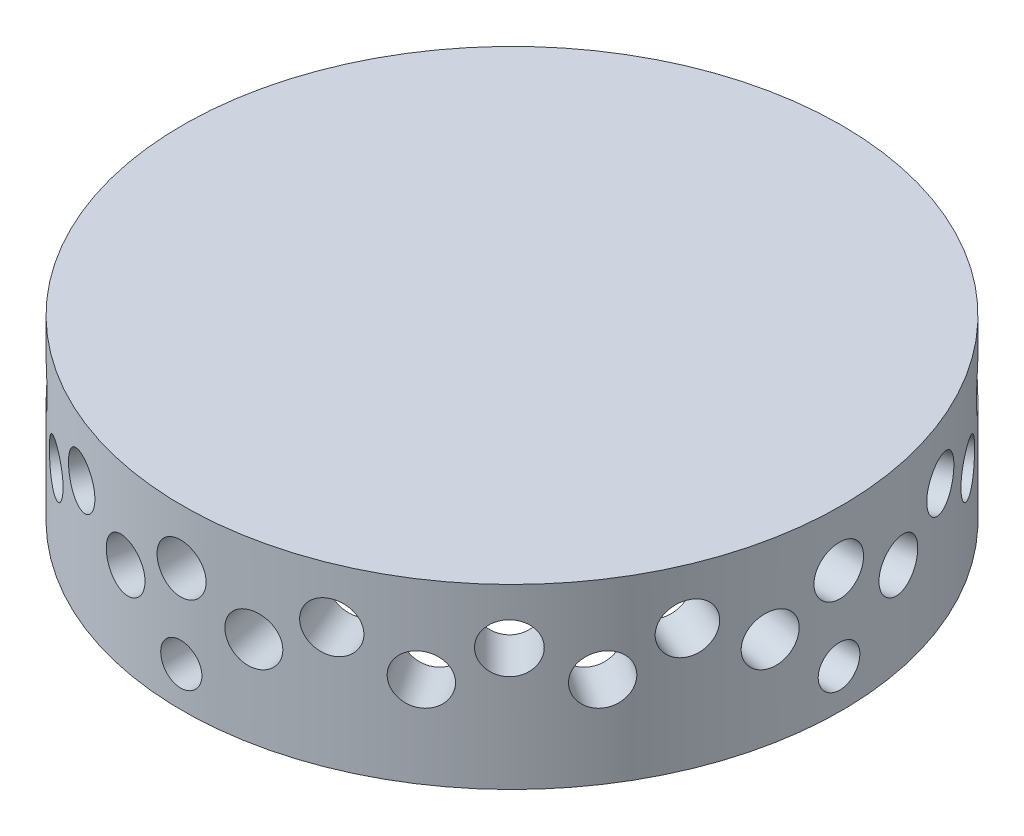
from build123d import *

# Parameters (mm, degrees)
WYTNIJ_WYCI_GNI_CIE2_REACH      = 201.702
WYTNIJ_WYCI_GNI_CIE2_END_RADIUS = 70.5
SZKIC2_R                        = 6.25
SZKIC4_R                        = 5.25
WYTNIJ_WYCI_GNI_CIE4_DEPTH      = 30
SZYK_KO_OWY2_COUNT              = 4
WYTNIJ_WYCI_GNI_CIE5_REACH      = 207.75
WYTNIJ_WYCI_GNI_CIE5_END_RADIUS = 70.5
SZKIC8_R                        = 6.25
SZYK_KO_OWY3_COUNT              = 16
SZYK_KO_OWY4_COUNT              = 16


with BuildPart() as part:
    # Szkic1 → Obrót1 (revolve)
    with BuildSketch(Plane.XY, mode=Mode.PRIVATE) as obr_t1_sk:
        Polygon((0, 70.848451872), (-83.5, 70.848451872), (-83.5, 40.848451872), (-83.5, 25.848451872), (-70.5, 25.848451872), (-70.5, 65.848451872), (0, 65.848451872), align=None)
    revolve(obr_t1_sk.sketch.rotate(Axis((0, -200.62943078, 0), (0, 1, 0)), 270), axis=Axis((0, -200.62943078, 0), (0, 1, 0)))

    # Wytnij-wyciągnięcie2: up to this cylinder (the profile starts outside it)
    wytnij_wyci_gni_cie2_end = Plane(origin=(0, 56.848452, 0), z_dir=(0, -1, 0)) * Cylinder(WYTNIJ_WYCI_GNI_CIE2_END_RADIUS, 545.404, mode=Mode.PRIVATE)
    # Szkic2 → Wytnij-wyciągnięcie2 (cut, up to the surface)
    with BuildSketch(Plane(origin=(83.5, 0, 0), x_dir=(0, 0, -1), z_dir=(1, 0, 0)), mode=Mode.PRIVATE) as wytnij_wyci_gni_cie2_sk1:
        with Locations((-0.467069002, 56.848451872)):
            Circle(SZKIC2_R)
    wytnij_wyci_gni_cie2_tool1 = extrude(wytnij_wyci_gni_cie2_sk1.sketch, amount=-WYTNIJ_WYCI_GNI_CIE2_REACH, mode=Mode.PRIVATE) - wytnij_wyci_gni_cie2_end
    wytnij_wyci_gni_cie2 = wytnij_wyci_gni_cie2_tool1.solids().sort_by_distance((83.5, 56.848452, 0.467069))[0]
    add(wytnij_wyci_gni_cie2, mode=Mode.SUBTRACT)

    # Szkic4 → Wytnij-wyciągnięcie4 (cut)
    with BuildSketch(Plane(origin=(83.5, 0, 0), x_dir=(0, 0, -1), z_dir=(1, 0, 0))):
        with Locations((-0.467069002, 35.848451872)):
            Circle(SZKIC4_R)
    wytnij_wyci_gni_cie4 = extrude(amount=-WYTNIJ_WYCI_GNI_CIE4_DEPTH, mode=Mode.SUBTRACT)

    # Szyk kołowy2: Wytnij-wyciągnięcie4 ×4 about axis
    szyk_ko_owy2_axis = Axis((0, 0, 0), (0, -1, 0))
    for i in range(1, SZYK_KO_OWY2_COUNT):
        add(wytnij_wyci_gni_cie4.rotate(szyk_ko_owy2_axis, i * 360 / SZYK_KO_OWY2_COUNT), mode=Mode.SUBTRACT)

    # Wytnij-wyciągnięcie5: up to this cylinder (the profile starts outside it)
    wytnij_wyci_gni_cie5_end = Plane(origin=(0, 48.848452, 0), z_dir=(0, -1, 0)) * Cylinder(WYTNIJ_WYCI_GNI_CIE5_END_RADIUS, 557.5, mode=Mode.PRIVATE)
    # Szkic8 → Wytnij-wyciągnięcie5 (cut, up to the surface)
    with BuildSketch(Plane(origin=(81.895570914, 0, 16.290041888), x_dir=(0, -1, 0), z_dir=(0.9807852804032304, 0, 0.19509032201612872)), mode=Mode.PRIVATE) as wytnij_wyci_gni_cie5_sk1:
        with Locations(Location((-48.848451872, 0, 0), (0, 0, 90))):
            Circle(SZKIC8_R)
    wytnij_wyci_gni_cie5_tool1 = extrude(wytnij_wyci_gni_cie5_sk1.sketch, amount=-WYTNIJ_WYCI_GNI_CIE5_REACH, mode=Mode.PRIVATE) - wytnij_wyci_gni_cie5_end
    wytnij_wyci_gni_cie5 = wytnij_wyci_gni_cie5_tool1.solids().sort_by_distance((81.895571, 48.848452, 16.290042))[0]
    add(wytnij_wyci_gni_cie5, mode=Mode.SUBTRACT)

    # Szyk kołowy3: Wytnij-wyciągnięcie2 ×16 about axis
    szyk_ko_owy3_axis = Axis((0, 0, 0), (0, -1, 0))
    for i in range(1, SZYK_KO_OWY3_COUNT):
        add(wytnij_wyci_gni_cie2.rotate(szyk_ko_owy3_axis, i * 360 / SZYK_KO_OWY3_COUNT), mode=Mode.SUBTRACT)

    # Szyk kołowy4: Wytnij-wyciągnięcie5 ×16 about axis
    szyk_ko_owy4_axis = Axis((0, 0, 0), (0, -1, 0))
    for i in range(1, SZYK_KO_OWY4_COUNT):
        add(wytnij_wyci_gni_cie5.rotate(szyk_ko_owy4_axis, i * 360 / SZYK_KO_OWY4_COUNT), mode=Mode.SUBTRACT)


solid = part.part
